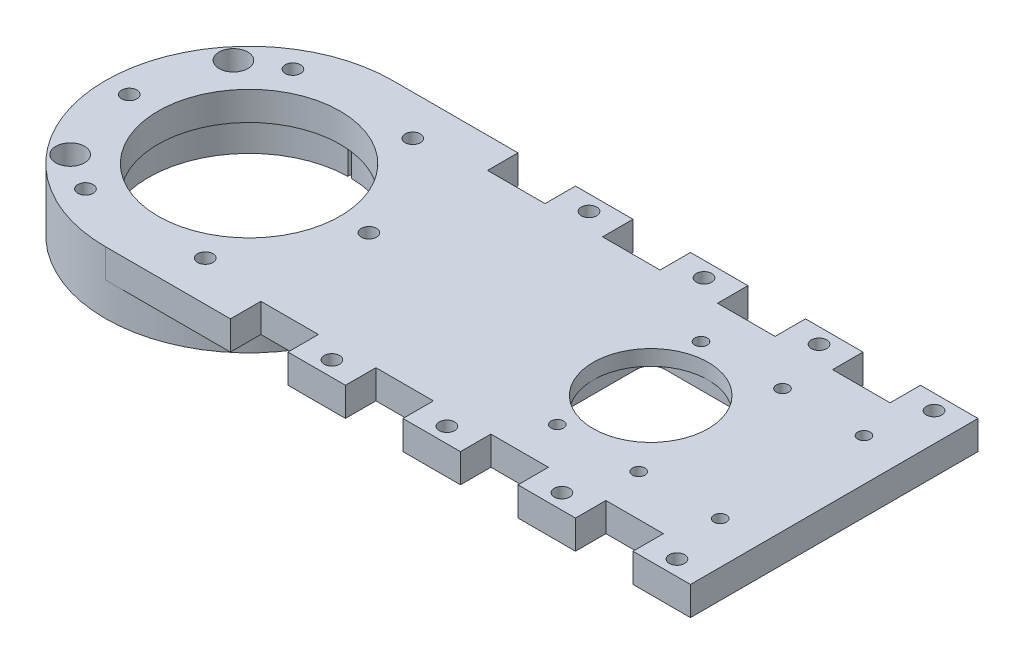
from build123d import *

# Parameters (mm, degrees)
SKETCH1_W           = 55.6
SKETCH1_H           = 35.6
SKETCH1_R           = 1.3
SKETCH1_W_2         = 45.4
SKETCH1_H_2         = 24.4
BOSS_EXTRUDE1_DEPTH = 2.8
BOSS_EXTRUDE2_START = 3.2
SKETCH1_5_W         = 55.6
SKETCH1_5_H         = 35.6
SKETCH1_5_R         = 1.3
SKETCH1_5_W_2       = 45.4
SKETCH1_5_H_2       = 24.4
SKETCH1_5_R_2       = 12
BOSS_EXTRUDE2_DEPTH = 3.2
FILLET1_R           = 3
BOSS_EXTRUDE3_START = -2.8
SKETCH2_R           = 19
BOSS_EXTRUDE3_DEPTH = 6
BOSS_EXTRUDE4_START = -7
SKETCH3_R           = 30
BOSS_EXTRUDE4_DEPTH = 7
SKETCH4_R           = 1.6
CUT_EXTRUDE1_DEPTH  = 119.413327375
SKETCH5_R           = 2.8
CUT_EXTRUDE2_DEPTH  = 3.5
BOSS_EXTRUDE5_START = -6
BOSS_EXTRUDE5_DEPTH = 6
SKETCH7_W           = 12
SKETCH7_H           = 6.35
CUT_EXTRUDE3_DEPTH  = 118.905538886
SKETCH8_R           = 1.6
CUT_EXTRUDE4_DEPTH  = 118.905538886
SKETCH9_R           = 1.6
CUT_EXTRUDE5_DEPTH  = 119.413327375
SKETCH10_R          = 3
CUT_EXTRUDE7_DEPTH  = 7


with BuildPart() as part:
    # Sketch1 → Boss-Extrude1 (new body)
    with BuildSketch(Plane(origin=(0, 0, 0), x_dir=(1, 0, 0), z_dir=(0, 1, 0))):
        with Locations((10.5, 0)):
            Rectangle(SKETCH1_W, SKETCH1_H)
        with Locations(Location((12.5, -15, 0), (0, 0, 270))):
            Circle(SKETCH1_R, mode=Mode.SUBTRACT)
        with Locations(Location((-4.5, 15, 0), (0, 0, 270))):
            Circle(SKETCH1_R, mode=Mode.SUBTRACT)
        with Locations(Location((12.5, 15, 0), (0, 0, 270))):
            Circle(SKETCH1_R, mode=Mode.SUBTRACT)
        with Locations(Location((29.5, 15, 0), (0, 0, 270))):
            Circle(SKETCH1_R, mode=Mode.SUBTRACT)
        with Locations(Location((29.5, -15, 0), (0, 0, 270))):
            Circle(SKETCH1_R, mode=Mode.SUBTRACT)
        with Locations(Location((-4.5, -15, 0), (0, 0, 270))):
            Circle(SKETCH1_R, mode=Mode.SUBTRACT)
        with Locations((10.5, 0)):
            Rectangle(SKETCH1_W_2, SKETCH1_H_2, mode=Mode.SUBTRACT)
    extrude(amount=-BOSS_EXTRUDE1_DEPTH)

    # Sketch1<5> → Boss-Extrude2 (add)
    # profile 1 of 2: a face of its own
    with BuildSketch(Plane(origin=(0, 0, 0), x_dir=(1, 0, 0), z_dir=(0, 1, 0)).offset(BOSS_EXTRUDE2_START)):
        with Locations((10.5, 0)):
            Rectangle(SKETCH1_5_W, SKETCH1_5_H)
        with Locations(Location((12.5, -15, 0), (0, 0, 270))):
            Circle(SKETCH1_5_R, mode=Mode.SUBTRACT)
        with Locations(Location((-4.5, 15, 0), (0, 0, 270))):
            Circle(SKETCH1_5_R, mode=Mode.SUBTRACT)
        with Locations(Location((12.5, 15, 0), (0, 0, 270))):
            Circle(SKETCH1_5_R, mode=Mode.SUBTRACT)
        with Locations(Location((29.5, 15, 0), (0, 0, 270))):
            Circle(SKETCH1_5_R, mode=Mode.SUBTRACT)
        with Locations(Location((29.5, -15, 0), (0, 0, 270))):
            Circle(SKETCH1_5_R, mode=Mode.SUBTRACT)
        with Locations(Location((-4.5, -15, 0), (0, 0, 270))):
            Circle(SKETCH1_5_R, mode=Mode.SUBTRACT)
        with Locations((10.5, 0)):
            Rectangle(SKETCH1_5_W_2, SKETCH1_5_H_2, mode=Mode.SUBTRACT)
    # profile 2 of 2: a face of its own
    with BuildSketch(Plane(origin=(0, 0, 0), x_dir=(1, 0, 0), z_dir=(0, 1, 0)).offset(BOSS_EXTRUDE2_START)):
        with Locations((10.5, 0)):
            Rectangle(SKETCH1_5_W_2, SKETCH1_5_H_2)
        with Locations(Location((0, 0, 0), (0, 0, 270))):
            Circle(SKETCH1_5_R_2, mode=Mode.SUBTRACT)
    extrude(amount=-BOSS_EXTRUDE2_DEPTH)

    # Fillet1
    fillet1_edges = [part.edges().sort_by_distance(p)[0] for p in [
        (-12.2, -1.4, -12.2),
        (-12.2, -1.4, 12.2),
        (33.2, -1.4, 12.2),
        (33.2, -1.4, -12.2),
    ]]
    fillet(fillet1_edges, radius=FILLET1_R)

    # Sketch2 → Boss-Extrude3 (add)
    with BuildSketch(Plane(origin=(0, 0, 0), x_dir=(1, 0, 0), z_dir=(0, 1, 0)).offset(BOSS_EXTRUDE3_START)):
        with BuildLine():
            Line((-17.3, 17.8), (-59.661294031, 17.8))
            ThreePointArc((-59.661294031, 17.8), (-113.81, 0), (-59.661294031, -17.8))
            Line((-59.661294031, -17.8), (-17.3, -17.8))
            Line((-17.3, -17.8), (-17.3, 17.8))
        make_face()
        with Locations(Location((-83.81, 0, 0), (0, 0, 270))):
            Circle(SKETCH2_R, mode=Mode.SUBTRACT)
    extrude(amount=BOSS_EXTRUDE3_DEPTH)

    # Sketch3 → Boss-Extrude4 (add)
    with BuildSketch(Plane(origin=(0, -2.8, 0), x_dir=(1, 0, 0), z_dir=(0, 1, 0)).offset(BOSS_EXTRUDE4_START)):
        with Locations(Location((-83.81, 0, 0), (0, 0, 36.393910191))):
            Circle(SKETCH3_R)
        with BuildLine():
            Line((-84.185, 20.996651519), (-84.185, 25.996651519))
            Line((-84.185, 25.996651519), (-83.435, 25.996651519))
            Line((-83.435, 25.996651519), (-83.435, 20.996651519))
            ThreePointArc((-83.435, 20.996651519), (-62.81, 0), (-83.435, -20.996651519))
            Line((-83.435, -20.996651519), (-83.435, -25.996651519))
            Line((-83.435, -25.996651519), (-84.185, -25.996651519))
            Line((-84.185, -25.996651519), (-84.185, -20.996651519))
            ThreePointArc((-84.185, -20.996651519), (-104.81, 0), (-84.185, 20.996651519))
        make_face(mode=Mode.SUBTRACT)
    extrude(amount=BOSS_EXTRUDE4_DEPTH)

    # Sketch4 → Cut-Extrude1 (cut, through all)
    with BuildSketch(Plane(origin=(0, 3.2, 0), x_dir=(1, 0, 0), z_dir=(0, 1, 0))):
        with Locations(Location((-58.81, 0, 0), (0, 0, 270))):
            Circle(SKETCH4_R)
        with Locations(Location((-71.31, -21.650635095, 0), (0, 0, 270))):
            Circle(SKETCH4_R)
        with Locations(Location((-96.31, -21.650635095, 0), (0, 0, 270))):
            Circle(SKETCH4_R)
        with Locations(Location((-108.81, 0, 0), (0, 0, 270))):
            Circle(SKETCH4_R)
        with Locations(Location((-96.31, 21.650635095, 0), (0, 0, 270))):
            Circle(SKETCH4_R)
        with Locations(Location((-71.31, 21.650635095, 0), (0, 0, 270))):
            Circle(SKETCH4_R)
    extrude(amount=-CUT_EXTRUDE1_DEPTH, mode=Mode.SUBTRACT)

    # Sketch5 → Cut-Extrude2 (cut)
    with BuildSketch(Plane(origin=(0, -9.8, 0), x_dir=(-1, 0, 0), z_dir=(0, -1, 0))):
        with Locations(Location((96.31, 21.650635095, 0), (0, 0, 90))):
            Circle(SKETCH5_R)
        with Locations(Location((108.81, 0, 0), (0, 0, 90))):
            Circle(SKETCH5_R)
        with Locations(Location((96.31, -21.650635095, 0), (0, 0, 90))):
            Circle(SKETCH5_R)
        with Locations(Location((71.31, -21.650635095, 0), (0, 0, 90))):
            Circle(SKETCH5_R)
        with Locations(Location((58.81, 0, 0), (0, 0, 90))):
            Circle(SKETCH5_R)
        with Locations(Location((71.31, 21.650635095, 0), (0, 0, 90))):
            Circle(SKETCH5_R)
    extrude(amount=-CUT_EXTRUDE2_DEPTH, mode=Mode.SUBTRACT)

    # Sketch6 → Boss-Extrude5 (add)
    with BuildSketch(Plane(origin=(0, 3.2, 0), x_dir=(1, 0, 0), z_dir=(0, 1, 0)).offset(BOSS_EXTRUDE5_START)):
        with BuildLine():
            Line((38.3, 17.8), (38.3, 30))
            Line((38.3, 30), (-83.81, 30))
            ThreePointArc((-83.81, 30), (-70.282250742, 26.776855678), (-59.661294031, 17.8))
            Line((-59.661294031, 17.8), (38.3, 17.8))
        make_face()
    boss_extrude5 = extrude(amount=BOSS_EXTRUDE5_DEPTH)

    # Mirror1: Boss-Extrude5 across plane
    add(boss_extrude5.mirror(Plane.XY))

    # Sketch7 → Cut-Extrude3 (cut, through all)
    with BuildSketch(Plane.XZ.offset(2.8)):
        with Locations((20.3, -26.825)):
            Rectangle(SKETCH7_W, SKETCH7_H)
        with Locations((-3.7, -26.825)):
            Rectangle(SKETCH7_W, SKETCH7_H)
        with Locations((-27.7, -26.825)):
            Rectangle(SKETCH7_W, SKETCH7_H)
        with Locations((-51.7, -26.825)):
            Rectangle(SKETCH7_W, SKETCH7_H)
    cut_extrude3 = extrude(amount=-CUT_EXTRUDE3_DEPTH, mode=Mode.SUBTRACT)

    # Mirror2: Cut-Extrude3 across plane
    add(cut_extrude3.mirror(Plane.XY), mode=Mode.SUBTRACT)

    # Sketch8 → Cut-Extrude4 (cut, through all)
    with BuildSketch(Plane.XZ.offset(2.8)):
        with Locations(Location((-39.7, -26.825, 0), (0, 0, 270))):
            Circle(SKETCH8_R)
        with Locations(Location((-15.7, -26.825, 0), (0, 0, 270))):
            Circle(SKETCH8_R)
        with Locations(Location((8.3, -26.825, 0), (0, 0, 270))):
            Circle(SKETCH8_R)
        with Locations(Location((32.3, -26.825, 0), (0, 0, 270))):
            Circle(SKETCH8_R)
    cut_extrude4 = extrude(amount=-CUT_EXTRUDE4_DEPTH, mode=Mode.SUBTRACT)

    # Mirror3: Cut-Extrude4 across plane
    add(cut_extrude4.mirror(Plane.XY), mode=Mode.SUBTRACT)

    # Sketch9 → Cut-Extrude5 (cut, through all)
    with BuildSketch(Plane(origin=(0, 3.2, 0), x_dir=(1, 0, 0), z_dir=(0, 1, 0))):
        with Locations(Location((-104.110177743, -17.033871657, 0), (0, 0, 270))):
            Circle(SKETCH9_R)
        with Locations(Location((-104.110177743, 17.033871657, 0), (0, 0, 270))):
            Circle(SKETCH9_R)
    extrude(amount=-CUT_EXTRUDE5_DEPTH, mode=Mode.SUBTRACT)

    # Sketch10 → Cut-Extrude7 (cut)
    with BuildSketch(Plane(origin=(0, 3.2, 0), x_dir=(1, 0, 0), z_dir=(0, 1, 0))):
        with Locations(Location((-104.110177743, 17.033871657, 0), (0, 0, 270))):
            Circle(SKETCH10_R)
        with Locations(Location((-104.110177743, -17.033871657, 0), (0, 0, 270))):
            Circle(SKETCH10_R)
    extrude(amount=-CUT_EXTRUDE7_DEPTH, mode=Mode.SUBTRACT)


solid = part.part
